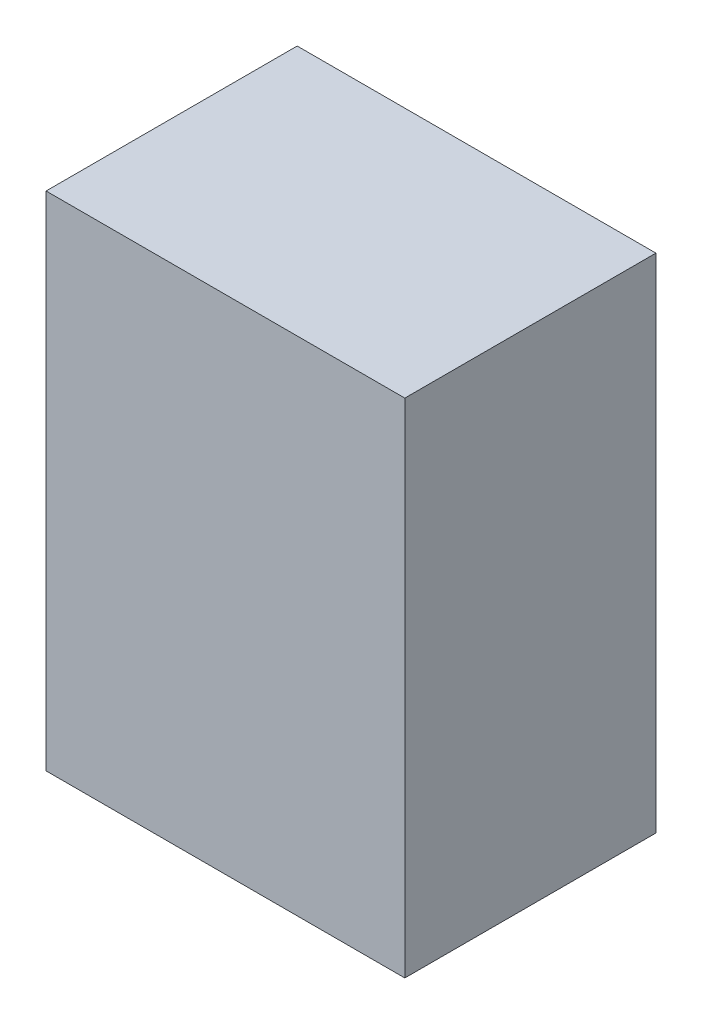
from build123d import *

# Parameters (mm, degrees)
SKETCH1_W     = 10
SKETCH1_H     = 14
PROFILE_DEPTH = 7


with BuildPart() as part:
    # Sketch1 → Profile (new body)
    with BuildSketch(Plane.XY):
        with Locations((5, 7)):
            Rectangle(SKETCH1_W, SKETCH1_H)
    extrude(amount=PROFILE_DEPTH)


solid = part.part
